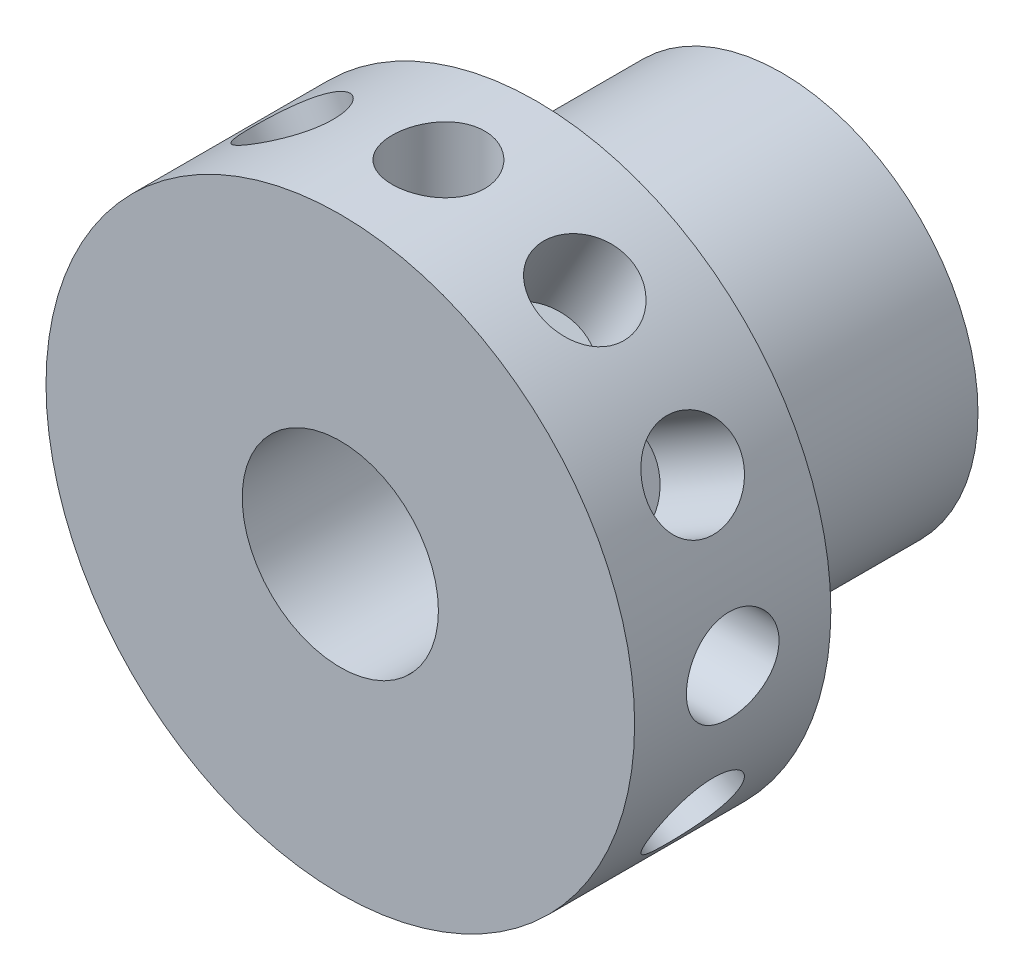
from build123d import *

# Parameters (mm, degrees)
SKETCH1_R           = 6
SKETCH1_R_2         = 4
SKETCH1_R_3         = 2
BOSS_EXTRUDE1_DEPTH = 2
SKETCH3_R           = 0.94375
CUT_EXTRUDE1_DEPTH  = 2
CIRPATTERN1_COUNT   = 12
BOSS_EXTRUDE2_START = -7
SKETCH1_3_R         = 4
SKETCH1_3_R_2       = 2
BOSS_EXTRUDE2_DEPTH = 5


with BuildPart() as part:
    # Sketch1 → Boss-Extrude1 (new, symmetric)
    # profile 1 of 2: a face of its own
    with BuildSketch(Plane.XY):
        Circle(SKETCH1_R)
        Circle(SKETCH1_R_2, mode=Mode.SUBTRACT)
    # profile 2 of 2: a face of its own
    with BuildSketch(Plane.XY):
        Circle(SKETCH1_R_2)
        Circle(SKETCH1_R_3, mode=Mode.SUBTRACT)
    extrude(amount=BOSS_EXTRUDE1_DEPTH, both=True)

    # Sketch3 → Cut-Extrude1 (cut)
    with BuildSketch(Plane(origin=(0, -6, 0), x_dir=(-1, 0, 0), z_dir=(0, -1, 0))):
        with Locations(Location((0, 0, 0), (0, 0, 90))):
            Circle(SKETCH3_R)
    cut_extrude1 = extrude(amount=-CUT_EXTRUDE1_DEPTH, mode=Mode.SUBTRACT)

    # CirPattern1: Cut-Extrude1 ×12 about axis
    cirpattern1_axis = Axis((0, 0, 0), (0, 0, 1))
    for i in range(1, CIRPATTERN1_COUNT):
        add(cut_extrude1.rotate(cirpattern1_axis, i * 360 / CIRPATTERN1_COUNT), mode=Mode.SUBTRACT)

    # Sketch1<3> → Boss-Extrude2 (add)
    with BuildSketch(Plane.XY.offset(BOSS_EXTRUDE2_START)):
        Circle(SKETCH1_3_R)
        Circle(SKETCH1_3_R_2, mode=Mode.SUBTRACT)
    extrude(amount=BOSS_EXTRUDE2_DEPTH)


solid = part.part
